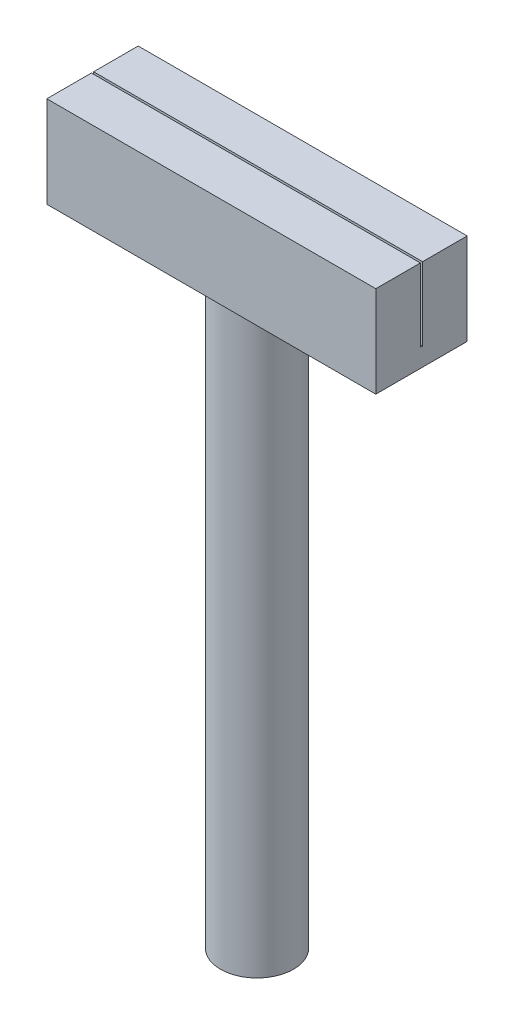
from build123d import *

# Parameters (mm, degrees)
SKETCH1_R               = 5
BOSS_EXTRUDE1_DEPTH     = 80
BOSS_EXTRUDE2_START     = 80
SKETCH2_W               = 44.999999916
SKETCH2_H               = 12.5
BOSS_EXTRUDE2_DEPTH     = 12.5
CUT_EXTRUDE1_DEPTH      = 96.402109506
CUT_EXTRUDE1_DEPTH_BACK = 96.402109506
SKETCH3_W               = 0.3
SKETCH3_H               = 10


with BuildPart() as part:
    # Sketch1 → Boss-Extrude1 (new body)
    with BuildSketch(Plane(origin=(0, 0, 0), x_dir=(1, 0, 0), z_dir=(0, 1, 0))):
        with Locations(Location((0, 0, 0), (0, 0, 270))):
            Circle(SKETCH1_R)
    extrude(amount=BOSS_EXTRUDE1_DEPTH)

    # Sketch2 → Boss-Extrude2 (add)
    with BuildSketch(Plane(origin=(0, 0, 0), x_dir=(1, 0, 0), z_dir=(0, 1, 0)).offset(BOSS_EXTRUDE2_START)):
        Rectangle(SKETCH2_W, SKETCH2_H)
    extrude(amount=BOSS_EXTRUDE2_DEPTH)

    # Sketch3 → Cut-Extrude1 (cut, two sides: drawn at the far end of the back side and taken through both)
    with BuildSketch(Plane(origin=(0, 0, 0), x_dir=(0, 0, -1), z_dir=(1, 0, 0)).offset(-CUT_EXTRUDE1_DEPTH_BACK)):
        with Locations((0, 87.5)):
            Rectangle(SKETCH3_W, SKETCH3_H)
    extrude(amount=CUT_EXTRUDE1_DEPTH + CUT_EXTRUDE1_DEPTH_BACK, mode=Mode.SUBTRACT)


solid = part.part
